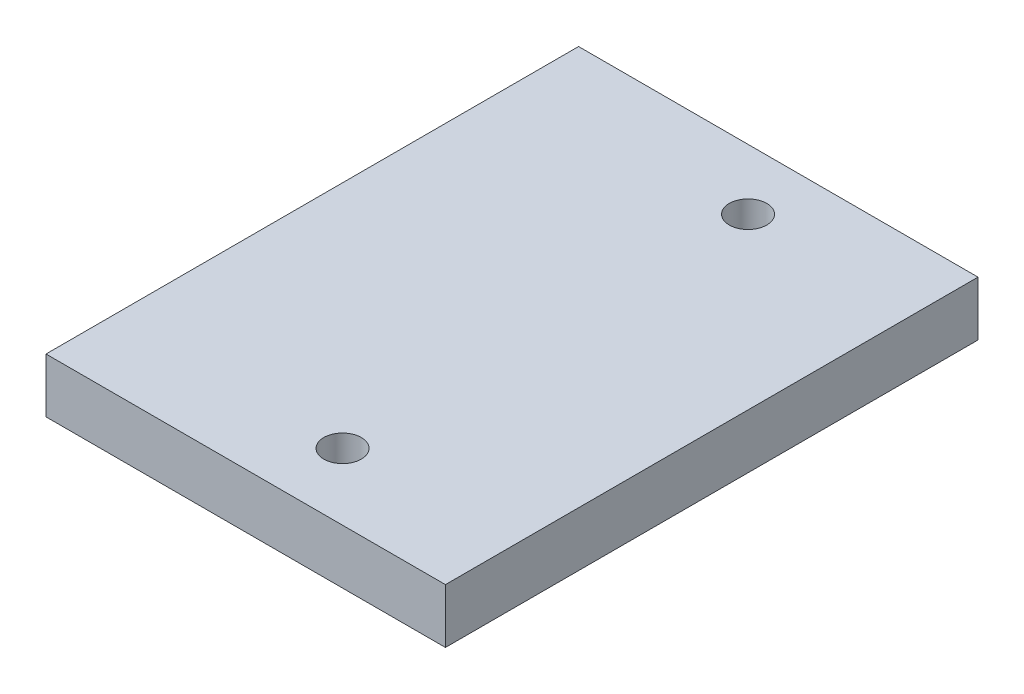
from build123d import *

# Parameters (mm, degrees)
CROQUIS1_W              = 37
CROQUIS1_H              = 44
SALIENTE_EXTRUIR1_DEPTH = 4.5
CROQUIS2_R              = 1.55
CORTAR_EXTRUIR1_DEPTH   = 4.5
CROQUIS3_W              = 1.5
CROQUIS3_H              = 44
CORTAR_EXTRUIR2_DEPTH   = 1
CROQUIS4_W              = 1.5
CROQUIS4_H              = 44
CORTAR_EXTRUIR3_DEPTH   = 1
CROQUIS8_W              = 4
CROQUIS8_H              = 44
CORTAR_EXTRUIR4_DEPTH   = 4.5


with BuildPart() as part:
    # Croquis1 → Saliente-Extruir1 (new body)
    with BuildSketch(Plane(origin=(0, 0, 0), x_dir=(1, 0, 0), z_dir=(0, 1, 0))):
        with Locations((18.5, 22)):
            Rectangle(CROQUIS1_W, CROQUIS1_H)
    extrude(amount=SALIENTE_EXTRUIR1_DEPTH)

    # Croquis2 → Cortar-Extruir1 (cut)
    with BuildSketch(Plane(origin=(0, 4.5, 0), x_dir=(1, 0, 0), z_dir=(0, 1, 0))):
        with Locations(Location((19, 39, 0), (0, 0, 270))):
            Circle(CROQUIS2_R)
        with Locations(Location((19, 5.5, 0), (0, 0, 270))):
            Circle(CROQUIS2_R)
    extrude(amount=-CORTAR_EXTRUIR1_DEPTH, mode=Mode.SUBTRACT)

    # Croquis3 → Cortar-Extruir2 (cut)
    with BuildSketch(Plane(origin=(0, 4.5, 0), x_dir=(1, 0, 0), z_dir=(0, 1, 0))):
        with Locations((33.75, 22)):
            Rectangle(CROQUIS3_W, CROQUIS3_H)
    extrude(amount=-CORTAR_EXTRUIR2_DEPTH, mode=Mode.SUBTRACT)

    # Croquis4 → Cortar-Extruir3 (cut)
    with BuildSketch(Plane.XZ):
        with Locations((33.75, -22)):
            Rectangle(CROQUIS4_W, CROQUIS4_H)
    extrude(amount=-CORTAR_EXTRUIR3_DEPTH, mode=Mode.SUBTRACT)

    # Croquis8 → Cortar-Extruir4 (cut)
    with BuildSketch(Plane(origin=(0, 4.5, 0), x_dir=(1, 0, 0), z_dir=(0, 1, 0))):
        with Locations((35, 22)):
            Rectangle(CROQUIS8_W, CROQUIS8_H)
    extrude(amount=-CORTAR_EXTRUIR4_DEPTH, mode=Mode.SUBTRACT)


solid = part.part
